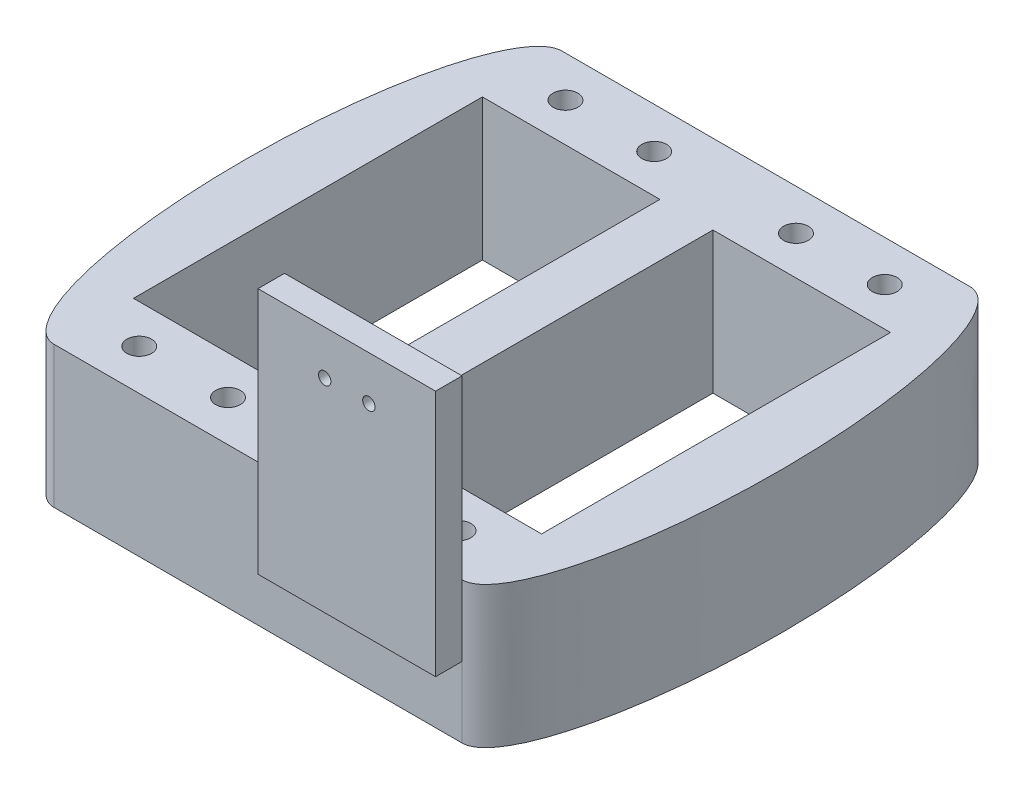
from build123d import *

# Parameters (mm, degrees)
EXTRUDE_2_DEPTH      = 8
EXTRUDE_2_DEPTH_BACK = 8
SKETCH_1_W           = 20.1
SKETCH_1_H           = 39.5
SKETCH_1_R           = 1.4
SKETCH_1_4_W         = 20.1
SKETCH_1_4_H         = 3
EXTRUDE_3_DEPTH      = 28
SKETCH_3_R           = 0.7
CUT_EXTRUDE_1_DEPTH  = 28


with BuildPart() as part:
    # Эскиз1 → Бобышка-Вытянуть2 (new, two sides: drawn at the far end of the back side and taken through both)
    with BuildSketch(Plane(origin=(0, 0, 0), x_dir=(1, 0, 0), z_dir=(0, 1, 0)).offset(-EXTRUDE_2_DEPTH_BACK)):
        with BuildLine():
            add(Edge.make_bspline(
                [(10.05, -28.75), (17.332372611, -28.75), (17.332372611, 0), (17.332372611, 28.75), (10.05, 28.75)],
                knots=[3.141592654, 3.141592654, 3.141592654, 4.71238898, 4.71238898, 6.283185307, 6.283185307, 6.283185307], degree=2, weights=[1, 0.707106781, 1, 0.707106781, 1]))
            Line((10.05, 28.75), (-36.15, 28.75))
            add(Edge.make_bspline(
                [(-36.15, 28.75), (-43.432372611, 28.75), (-43.432372611, 0), (-43.432372611, -28.75), (-36.15, -28.75)],
                knots=[0, 0, 0, 1.570796327, 1.570796327, 3.141592654, 3.141592654, 3.141592654], degree=2, weights=[1, 0.707106781, 1, 0.707106781, 1]))
            Line((-36.15, -28.75), (10.05, -28.75))
        make_face()
        with Locations((-26.1, 0)):
            Rectangle(SKETCH_1_W, SKETCH_1_H, mode=Mode.SUBTRACT)
        Rectangle(SKETCH_1_W, SKETCH_1_H, mode=Mode.SUBTRACT)
        with Locations((5.025, -24.125)):
            Circle(SKETCH_1_R, mode=Mode.SUBTRACT)
        with Locations((-5.025, -24.125)):
            Circle(SKETCH_1_R, mode=Mode.SUBTRACT)
        with Locations((-21.075, -24.125)):
            Circle(SKETCH_1_R, mode=Mode.SUBTRACT)
        with Locations((-31.125, -24.125)):
            Circle(SKETCH_1_R, mode=Mode.SUBTRACT)
        with Locations((-21.075, 24.125)):
            Circle(SKETCH_1_R, mode=Mode.SUBTRACT)
        with Locations((-31.125, 24.125)):
            Circle(SKETCH_1_R, mode=Mode.SUBTRACT)
        with Locations((5.025, 24.125)):
            Circle(SKETCH_1_R, mode=Mode.SUBTRACT)
        with Locations((-5.025, 24.125)):
            Circle(SKETCH_1_R, mode=Mode.SUBTRACT)
    extrude(amount=EXTRUDE_2_DEPTH + EXTRUDE_2_DEPTH_BACK)

    # Эскиз1<4> → Бобышка-Вытянуть3 (add)
    with BuildSketch(Plane(origin=(0, 0, 0), x_dir=(1, 0, 0), z_dir=(0, 1, 0))):
        with Locations((0, -30.25)):
            Rectangle(SKETCH_1_4_W, SKETCH_1_4_H)
    extrude(amount=EXTRUDE_3_DEPTH)

    # Эскиз3 → Вырез-Вытянуть1 (cut)
    with BuildSketch(Plane(origin=(0, 0, 28.75), x_dir=(-1, 0, 0), z_dir=(0, 0, -1))):
        with Locations((-2.5, 23)):
            Circle(SKETCH_3_R)
        with Locations((2.5, 23)):
            Circle(SKETCH_3_R)
    extrude(amount=-CUT_EXTRUDE_1_DEPTH, mode=Mode.SUBTRACT)


solid = part.part
